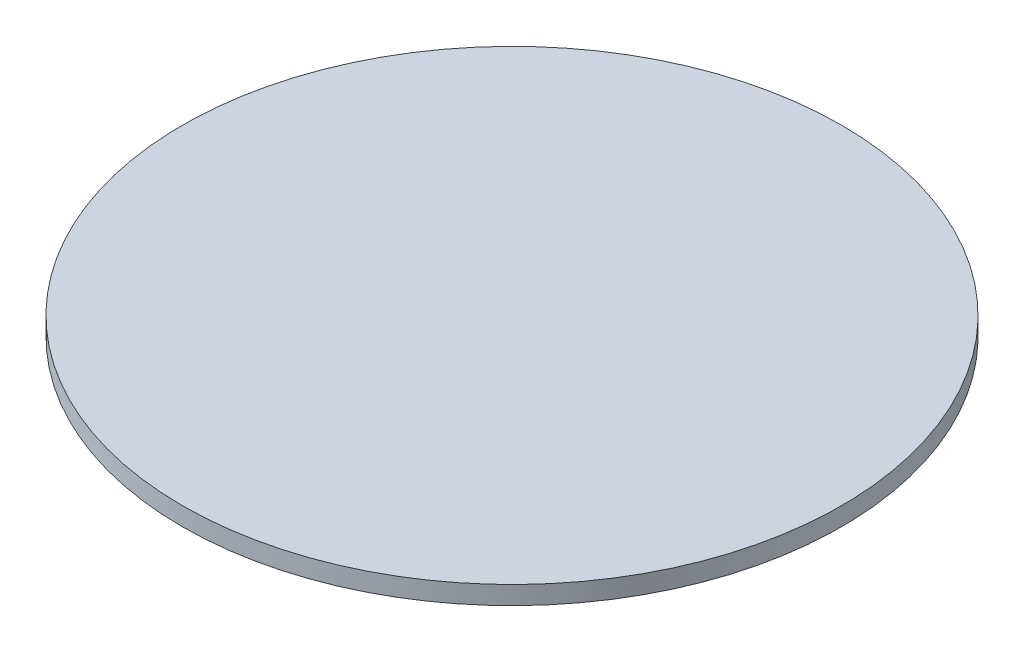
from build123d import *

# Parameters (mm, degrees)
SKETCH1_R           = 27
BOSS_EXTRUDE1_DEPTH = 1.5


with BuildPart() as part:
    # Sketch1 → Boss-Extrude1 (new body)
    with BuildSketch(Plane(origin=(0, 0, 0), x_dir=(1, 0, 0), z_dir=(0, 1, 0))):
        with Locations(Location((0, 0, 0), (0, 0, 270))):
            Circle(SKETCH1_R)
    extrude(amount=BOSS_EXTRUDE1_DEPTH)


solid = part.part
